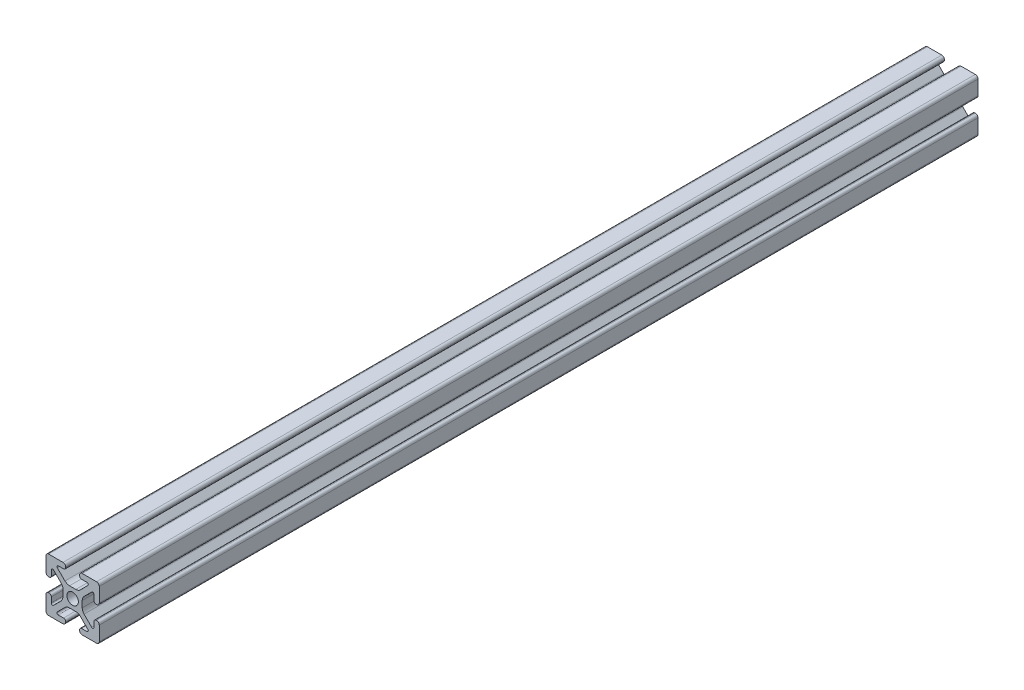
from build123d import *

# Parameters (mm, degrees)
ESQUISSE1_R        = 2.15
BOSS_EXTRU_1_DEPTH = 330


with BuildPart() as part:
    # Esquisse1 → Boss.-Extru.1 (new body)
    with BuildSketch(Plane.XY):
        with BuildLine():
            Line((-2.88569967, 4.299913232), (-5.732233047, 7.146446609))
            ThreePointArc((-5.732233047, 7.146446609), (-5.840619423, 7.691341716), (-5.378679656, 8))
            Line((-5.378679656, 8), (-3.4, 8))
            ThreePointArc((-3.4, 8), (-2.834314575, 8.234314575), (-2.6, 8.8))
            Line((-2.6, 8.8), (-2.6, 9))
            ThreePointArc((-2.6, 9), (-2.892893219, 9.707106781), (-3.6, 10))
            Line((-3.6, 10), (-9, 10))
            ThreePointArc((-9, 10), (-9.707106781, 9.707106781), (-10, 9))
            Line((-10, 9), (-10, 3.6))
            ThreePointArc((-10, 3.6), (-9.707106781, 2.892893219), (-9, 2.6))
            Line((-9, 2.6), (-8.8, 2.6))
            ThreePointArc((-8.8, 2.6), (-8.234314575, 2.834314575), (-8, 3.4))
            Line((-8, 3.4), (-8, 5.378679656))
            ThreePointArc((-8, 5.378679656), (-7.691341716, 5.840619423), (-7.146446609, 5.732233047))
            Line((-7.146446609, 5.732233047), (-4.299913232, 2.88569967))
            ThreePointArc((-4.299913232, 2.88569967), (-3.781901523, 2.11044036), (-3.6, 1.195959652))
            Line((-3.6, 1.195959652), (-3.6, -1.195959652))
            ThreePointArc((-3.6, -1.195959652), (-3.848742051, -2.082754106), (-4.299913232, -2.88569967))
            Line((-4.299913232, -2.88569967), (-7.146446609, -5.732233047))
            ThreePointArc((-7.146446609, -5.732233047), (-7.691341716, -5.840619423), (-8, -5.378679656))
            Line((-8, -5.378679656), (-8, -3.4))
            ThreePointArc((-8, -3.4), (-8.234314575, -2.834314575), (-8.8, -2.6))
            Line((-8.8, -2.6), (-9, -2.6))
            ThreePointArc((-9, -2.6), (-9.707106781, -2.892893219), (-10, -3.6))
            Line((-10, -3.6), (-10, -9))
            ThreePointArc((-10, -9), (-9.707106781, -9.707106781), (-9, -10))
            Line((-9, -10), (-3.6, -10))
            ThreePointArc((-3.6, -10), (-2.9487738, -9.6512262), (-2.6, -9))
            Line((-2.6, -9), (-2.6, -8.8))
            ThreePointArc((-2.6, -8.8), (-2.834314575, -8.234314575), (-3.4, -8))
            Line((-3.4, -8), (-5.378679656, -8))
            ThreePointArc((-5.378679656, -8), (-5.840619423, -7.691341716), (-5.732233047, -7.146446609))
            Line((-5.732233047, -7.146446609), (-2.88569967, -4.299913232))
            ThreePointArc((-2.88569967, -4.299913232), (-2.11044036, -3.781901523), (-1.195959652, -3.6))
            Line((-1.195959652, -3.6), (1.195959652, -3.6))
            ThreePointArc((1.195959652, -3.6), (2.11044036, -3.781901523), (2.88569967, -4.299913232))
            Line((2.88569967, -4.299913232), (5.732233047, -7.146446609))
            ThreePointArc((5.732233047, -7.146446609), (5.840619423, -7.691341716), (5.378679656, -8))
            Line((5.378679656, -8), (3.4, -8))
            ThreePointArc((3.4, -8), (2.834314575, -8.234314575), (2.6, -8.8))
            Line((2.6, -8.8), (2.6, -9))
            ThreePointArc((2.6, -9), (2.892893219, -9.707106781), (3.6, -10))
            Line((3.6, -10), (9, -10))
            ThreePointArc((9, -10), (9.707106781, -9.707106781), (10, -9))
            Line((10, -9), (10, -3.6))
            ThreePointArc((10, -3.6), (9.707106781, -2.892893219), (9, -2.6))
            Line((9, -2.6), (8.8, -2.6))
            ThreePointArc((8.8, -2.6), (8.234314575, -2.834314575), (8, -3.4))
            Line((8, -3.4), (8, -5.378679656))
            ThreePointArc((8, -5.378679656), (7.691341716, -5.840619423), (7.146446609, -5.732233047))
            Line((7.146446609, -5.732233047), (4.299913232, -2.88569967))
            ThreePointArc((4.299913232, -2.88569967), (3.781901523, -2.11044036), (3.6, -1.195959652))
            Line((3.6, -1.195959652), (3.6, 1.195959652))
            ThreePointArc((3.6, 1.195959652), (3.781901523, 2.11044036), (4.299913232, 2.88569967))
            Line((4.299913232, 2.88569967), (7.146446609, 5.732233047))
            ThreePointArc((7.146446609, 5.732233047), (7.691341716, 5.840619423), (8, 5.378679656))
            Line((8, 5.378679656), (8, 3.4))
            ThreePointArc((8, 3.4), (8.234314575, 2.834314575), (8.8, 2.6))
            Line((8.8, 2.6), (9, 2.6))
            ThreePointArc((9, 2.6), (9.707106781, 2.892893219), (10, 3.6))
            Line((10, 3.6), (10, 9))
            ThreePointArc((10, 9), (9.707106781, 9.707106781), (9, 10))
            Line((9, 10), (3.6, 10))
            ThreePointArc((3.6, 10), (2.892893219, 9.707106781), (2.6, 9))
            Line((2.6, 9), (2.6, 8.8))
            ThreePointArc((2.6, 8.8), (2.834314575, 8.234314575), (3.4, 8))
            Line((3.4, 8), (5.378679656, 8))
            ThreePointArc((5.378679656, 8), (5.840619423, 7.691341716), (5.732233047, 7.146446609))
            Line((5.732233047, 7.146446609), (2.88569967, 4.299913232))
            ThreePointArc((2.88569967, 4.299913232), (2.11044036, 3.781901523), (1.195959652, 3.6))
            Line((1.195959652, 3.6), (-1.195959652, 3.6))
            ThreePointArc((-1.195959652, 3.6), (-2.089634332, 3.832131718), (-2.88569967, 4.299913232))
        make_face()
        Circle(ESQUISSE1_R, mode=Mode.SUBTRACT)
    extrude(amount=BOSS_EXTRU_1_DEPTH)


solid = part.part
